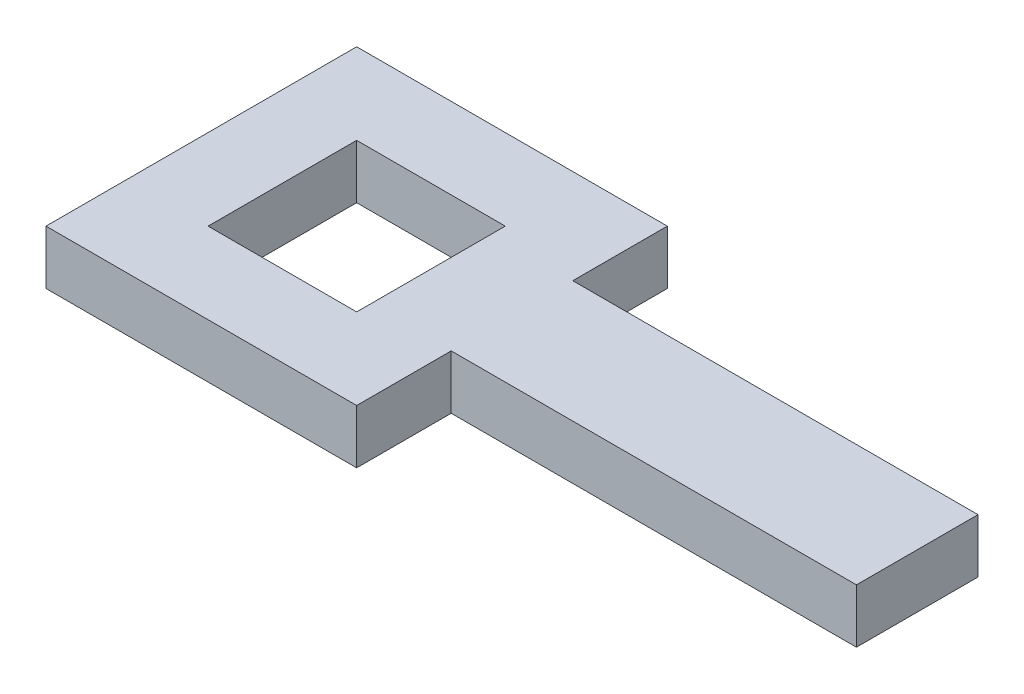
from build123d import *

# Parameters (mm, degrees)
SKETCH1_W           = 23
SKETCH1_H           = 23
BOSS_EXTRUDE1_DEPTH = 4
SKETCH2_W           = 11
SKETCH2_H           = 11
CUT_EXTRUDE1_DEPTH  = 4
SKETCH3_W           = 9
SKETCH3_H           = 4
BOSS_EXTRUDE2_DEPTH = 30


with BuildPart() as part:
    # Sketch1 → Boss-Extrude1 (new body)
    with BuildSketch(Plane(origin=(0, 0, 0), x_dir=(1, 0, 0), z_dir=(0, 1, 0))):
        with Locations((-0.318811881, 0.227722772)):
            Rectangle(SKETCH1_W, SKETCH1_H)
    extrude(amount=BOSS_EXTRUDE1_DEPTH)

    # Sketch2 → Cut-Extrude1 (cut)
    with BuildSketch(Plane(origin=(0, 4, 0), x_dir=(1, 0, 0), z_dir=(0, 1, 0))):
        with Locations((-0.318811881, 0.227722772)):
            Rectangle(SKETCH2_W, SKETCH2_H)
    extrude(amount=-CUT_EXTRUDE1_DEPTH, mode=Mode.SUBTRACT)

    # Sketch3 → Boss-Extrude2 (add)
    with BuildSketch(Plane(origin=(11.181188119, 0, 0), x_dir=(0, 0, -1), z_dir=(1, 0, 0))):
        with Locations((0.227722772, 2)):
            Rectangle(SKETCH3_W, SKETCH3_H)
    extrude(amount=BOSS_EXTRUDE2_DEPTH)


solid = part.part
